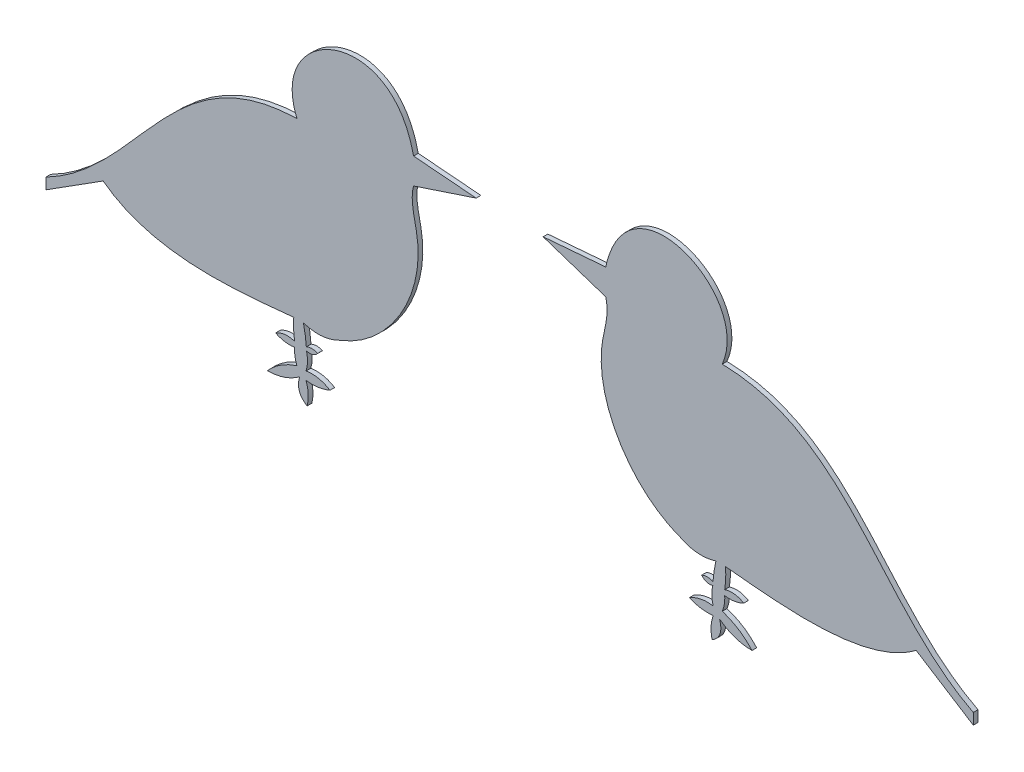
from build123d import *

# Parameters (mm, degrees)
BOSS_EXTRUDE1_DEPTH   = 3.175
BOSS_EXTRUDE1_2_DEPTH = 3.175


with BuildPart() as part:
    # Sketch1 → Boss-Extrude1 (new body)
    with BuildSketch(Plane.XY):
        with BuildLine():
            Line((87.113919375, 154.027891238), (129.420352067, 150.562076769))
            Line((129.420352067, 150.562076769), (87.113919375, 136.540935247))
            add(Edge.make_bspline(
                [(37.237390471, 21.222876939), (70.113078244, 33.521092704), (101.331207371, 83.359211821), (84.503522649, 127.088417674), (87.113919375, 136.540935247)],
                knots=[0, 0, 0, 0, 0.790173508, 1, 1, 1, 1], degree=3))
            add(Edge.make_bspline(
                [(12.61174712, 19.099962546), (25.411659158, 15.070057004), (37.237390471, 21.222876939)],
                knots=[0, 0, 0, 1, 1, 1], degree=2))
            add(Edge.make_bspline(
                [(14.568109931, 6.0395201), (14.095506124, 12.591987305), (12.61174712, 19.099962546)],
                knots=[0.519389879, 0.519389879, 0.519389879, 1, 1, 1], degree=2))
            add(Edge.make_bspline(
                [(14.568109931, 6.0395201), (18.497169183, 7.844495738), (22.239776513, 6.009689266)],
                knots=[0, 0, 0, 1, 1, 1], degree=2))
            add(Edge.make_bspline(
                [(22.239776513, 6.009689266), (19.267647268, 2.52301559), (14.706588007, 3.654225883)],
                knots=[0, 0, 0, 1, 1, 1], degree=2))
            add(Edge.make_bspline(
                [(14.40866916, -8.174794729), (16.194892919, -2.297522761), (14.706588007, 3.654225883)],
                knots=[0, 0, 0, 1, 1, 1], degree=2))
            add(Edge.make_bspline(
                [(30.580967513, -11.386655468), (23.054859283, -6.767777046), (14.40866916, -8.174794729)],
                knots=[0, 0, 0, 1, 1, 1], degree=2))
            add(Edge.make_bspline(
                [(14.40866916, -13.736774366), (22.777620592, -14.702134943), (30.580967513, -11.386655468)],
                knots=[0, 0, 0, 1, 1, 1], degree=2))
            add(Edge.make_bspline(
                [(15.127437975, -28.277722637), (16.94512335, -21.015961132), (14.40866916, -13.736774366)],
                knots=[0, 0, 0, 1, 1, 1], degree=2))
            add(Edge.make_bspline(
                [(10.096056265, -13.736774366), (7.084149985, -23.415624205), (15.127437975, -28.277722637)],
                knots=[0, 0, 0, 1, 1, 1], degree=2))
            add(Edge.make_bspline(
                [(-11.826392613, -21.09003448), (0.107623037, -21.050157795), (10.096056265, -13.736774366)],
                knots=[0, 0, 0, 1, 1, 1], degree=2))
            add(Edge.make_bspline(
                [(8.286691916, -8.174794729), (-3.597506393, -11.947847819), (-11.826392613, -21.09003448)],
                knots=[0, 0, 0, 1, 1, 1], degree=2))
            add(Edge.make_bspline(
                [(6.662637903, 1.795930355), (6.308690545, -3.429784383), (8.286691916, -8.174794729)],
                knots=[0, 0, 0, 1, 1, 1], degree=2))
            add(Edge.make_bspline(
                [(-6.182152926, 3.795070158), (-0.078965126, 0.770932331), (6.662637903, 1.795930355)],
                knots=[0, 0, 0, 1, 1, 1], degree=2))
            add(Edge.make_bspline(
                [(6.662637903, 5.271482897), (-0.10810119, 7.501609225), (-6.182152926, 3.795070158)],
                knots=[0, 0, 0, 1, 1, 1], degree=2))
            add(Edge.make_bspline(
                [(6.097375444, 19.099962546), (5.565064553, 12.127998482), (6.662637903, 5.271482897)],
                knots=[0, 0, 0, 1, 1, 1], degree=2))
            add(Edge.make_bspline(
                [(-122.81044511, 34.471930675), (-87.954170711, 8.06822127), (-30.548617864, 15.586902078), (6.097375444, 19.099962546)],
                knots=[0, 0, 0, 0, 1, 1, 1, 1], degree=3))
            Line((-122.81044511, 34.471930675), (-161.450370656, 9.970725084))
            Line((-161.450370656, 9.970725084), (-161.450370656, 17.460429913))
            add(Edge.make_bspline(
                [(8.286691916, 136.540935247), (-76.942196875, 134.682911592), (-97.632880087, 50.116389354), (-161.450370656, 17.460429913)],
                knots=[0, 0, 0, 0, 1, 1, 1, 1], degree=3))
            add(Edge.make_bspline(
                [(87.113919375, 154.027891238), (71.999941775, 223.210938824), (-12.616412859, 185.34808031), (8.286691916, 136.540935247)],
                knots=[0, 0, 0, 0, 1, 1, 1, 1], degree=3))
        make_face()
    extrude(amount=BOSS_EXTRUDE1_DEPTH)


with BuildPart() as body_2:
    # Sketch1 → Boss-Extrude1 2 (new body)
    with BuildSketch(Plane.XY):
        with BuildLine():
            Line((465.590603009, 9.970725084), (426.950677463, 34.471930675))
            add(Edge.make_bspline(
                [(426.950677463, 34.471930675), (392.094403064, 8.06822127), (334.688850216, 15.586902078), (298.042856909, 19.099962546)],
                knots=[0, 0, 0, 0, 1, 1, 1, 1], degree=3))
            add(Edge.make_bspline(
                [(298.042856909, 19.099962546), (298.5751678, 12.127998482), (297.47759445, 5.271482897)],
                knots=[0, 0, 0, 1, 1, 1], degree=2))
            add(Edge.make_bspline(
                [(297.47759445, 5.271482897), (304.248333543, 7.501609225), (310.322385279, 3.795070158)],
                knots=[0, 0, 0, 1, 1, 1], degree=2))
            add(Edge.make_bspline(
                [(310.322385279, 3.795070158), (304.219197479, 0.770932331), (297.47759445, 1.795930355)],
                knots=[0, 0, 0, 1, 1, 1], degree=2))
            add(Edge.make_bspline(
                [(297.47759445, 1.795930355), (297.831541808, -3.429784383), (295.853540437, -8.174794729)],
                knots=[0, 0, 0, 1, 1, 1], degree=2))
            add(Edge.make_bspline(
                [(295.853540437, -8.174794729), (307.737738746, -11.947847819), (315.966624966, -21.09003448)],
                knots=[0, 0, 0, 1, 1, 1], degree=2))
            add(Edge.make_bspline(
                [(315.966624966, -21.09003448), (304.032609316, -21.050157795), (294.044176087, -13.736774366)],
                knots=[0, 0, 0, 1, 1, 1], degree=2))
            add(Edge.make_bspline(
                [(294.044176087, -13.736774366), (297.056082368, -23.415624205), (289.012794378, -28.277722637)],
                knots=[0, 0, 0, 1, 1, 1], degree=2))
            add(Edge.make_bspline(
                [(289.012794378, -28.277722637), (287.195109003, -21.015961132), (289.731563193, -13.736774366)],
                knots=[0, 0, 0, 1, 1, 1], degree=2))
            add(Edge.make_bspline(
                [(289.731563193, -13.736774366), (281.362611761, -14.702134943), (273.55926484, -11.386655468)],
                knots=[0, 0, 0, 1, 1, 1], degree=2))
            add(Edge.make_bspline(
                [(273.55926484, -11.386655468), (281.085373069, -6.767777046), (289.731563193, -8.174794729)],
                knots=[0, 0, 0, 1, 1, 1], degree=2))
            add(Edge.make_bspline(
                [(289.731563193, -8.174794729), (287.945339433, -2.297522761), (289.433644346, 3.654225883)],
                knots=[0, 0, 0, 1, 1, 1], degree=2))
            add(Edge.make_bspline(
                [(281.90045584, 6.009689266), (284.872585085, 2.52301559), (289.433644346, 3.654225883)],
                knots=[0, 0, 0, 1, 1, 1], degree=2))
            add(Edge.make_bspline(
                [(289.572122421, 6.0395201), (285.64306317, 7.844495738), (281.90045584, 6.009689266)],
                knots=[0, 0, 0, 1, 1, 1], degree=2))
            add(Edge.make_bspline(
                [(289.572122421, 6.0395201), (290.044726229, 12.591987305), (291.528485233, 19.099962546)],
                knots=[0.519389879, 0.519389879, 0.519389879, 1, 1, 1], degree=2))
            add(Edge.make_bspline(
                [(291.528485233, 19.099962546), (278.728573195, 15.070057004), (266.902841882, 21.222876939)],
                knots=[0, 0, 0, 1, 1, 1], degree=2))
            add(Edge.make_bspline(
                [(266.902841882, 21.222876939), (234.027154109, 33.521092704), (202.809024982, 83.359211821), (219.636709704, 127.088417674), (217.026312977, 136.540935247)],
                knots=[0, 0, 0, 0, 0.790173508, 1, 1, 1, 1], degree=3))
            Line((217.026312977, 136.540935247), (174.719880286, 150.562076769))
            Line((174.719880286, 150.562076769), (217.026312977, 154.027891238))
            add(Edge.make_bspline(
                [(217.026312977, 154.027891238), (232.140290578, 223.210938824), (316.756645212, 185.34808031), (295.853540437, 136.540935247)],
                knots=[0, 0, 0, 0, 1, 1, 1, 1], degree=3))
            add(Edge.make_bspline(
                [(295.853540437, 136.540935247), (381.082429227, 134.682911592), (401.77311244, 50.116389354), (465.590603009, 17.460429913)],
                knots=[0, 0, 0, 0, 1, 1, 1, 1], degree=3))
            Line((465.590603009, 17.460429913), (465.590603009, 9.970725084))
        make_face()
    extrude(amount=BOSS_EXTRUDE1_2_DEPTH)


solid = Compound([part.part, body_2.part])
